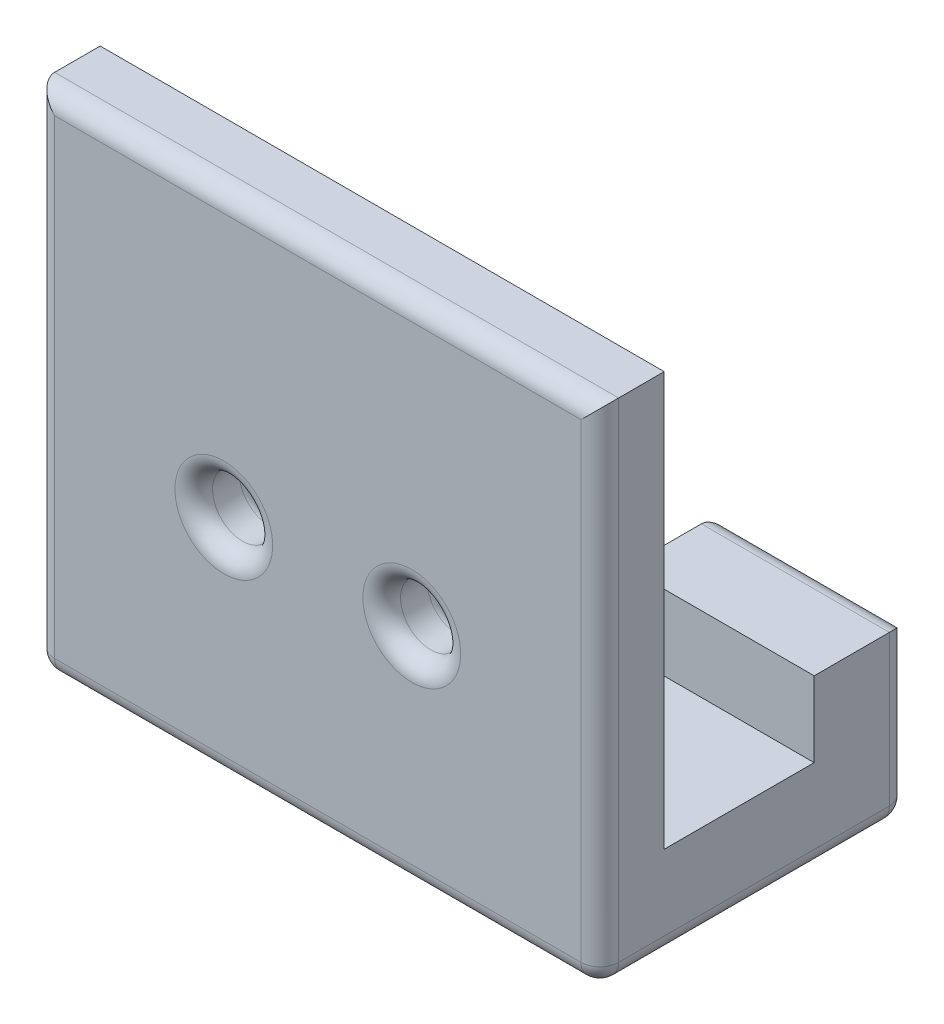
from build123d import *

# Parameters (mm, degrees)
BOSS_EXTRUDE1_DEPTH = 5
SKETCH1_3_W         = 10
SKETCH1_3_H         = 5
BOSS_EXTRUDE2_DEPTH = 9
BOSS_EXTRUDE3_DEPTH = 22
SKETCH4_R           = 1.6
CUT_EXTRUDE1_DEPTH  = 3.424711692
FILLET1_R           = 1
FILLET2_R           = 1


with BuildPart() as part:
    # Sketch1 → Boss-Extrude1 (new body)
    with BuildSketch(Plane(origin=(0, 0, 0), x_dir=(1, 0, 0), z_dir=(0, 1, 0))):
        Polygon((-44.61462686, -35.123247006), (-14.61462686, -35.123247006), (-14.61462686, -18.720861087), (-24.61462686, -18.720861087), (-24.61462686, -25.920861087), (-34.61462686, -25.920861087), (-34.61462686, -18.720861087), (-44.61462686, -18.720861087), align=None)
    extrude(amount=BOSS_EXTRUDE1_DEPTH)

    # Sketch1<3> → Boss-Extrude2 (add)
    with BuildSketch(Plane(origin=(0, 0, 0), x_dir=(1, 0, 0), z_dir=(0, 1, 0))):
        with Locations((-39.61462686, -21.220861087)):
            Rectangle(SKETCH1_3_W, SKETCH1_3_H)
        with Locations((-19.61462686, -21.220861087)):
            Rectangle(SKETCH1_3_W, SKETCH1_3_H)
    extrude(amount=BOSS_EXTRUDE2_DEPTH)

    # Sketch3 → Boss-Extrude3 (add)
    with BuildSketch(Plane(origin=(0, 5, 0), x_dir=(1, 0, 0), z_dir=(0, 1, 0))):
        Polygon((-34.61462686, -31.698535314), (-44.61462686, -31.698535314), (-44.61462686, -35.123247006), (-14.61462686, -35.123247006), (-14.61462686, -31.698535314), align=None)
    extrude(amount=BOSS_EXTRUDE3_DEPTH)

    # Sketch4 → Cut-Extrude1 (cut)
    with BuildSketch(Plane(origin=(0, 0, 31.698535314), x_dir=(-1, 0, 0), z_dir=(0, 0, -1))):
        with Locations((34.61462686, 12)):
            Circle(SKETCH4_R)
        with Locations((24.61462686, 12)):
            Circle(SKETCH4_R)
    extrude(amount=-CUT_EXTRUDE1_DEPTH, mode=Mode.SUBTRACT)

    # Fillet1
    fillet1_edges = [part.edges().sort_by_distance(p)[0] for p in [
        (-33.01462686, 12, 31.698535314),
        (-33.01462686, 12, 35.123247006),
        (-23.01462686, 12, 31.698535314),
        (-23.01462686, 12, 35.123247006),
    ]]
    fillet(fillet1_edges, radius=FILLET1_R)

    # Fillet2
    fillet2_edges = [part.edges().sort_by_distance(p)[0] for p in [
        (-39.61462686, 0, 18.720861087),
        (-34.61462686, 0, 22.320861087),
        (-29.61462686, 0, 25.920861087),
        (-24.61462686, 0, 22.320861087),
        (-19.61462686, 0, 18.720861087),
        (-14.61462686, 0, 26.922054046),
        (-14.61462686, 13.5, 35.123247006),
        (-44.61462686, 13.5, 35.123247006),
        (-44.61462686, 4.5, 18.720861087),
        (-34.61462686, 4.5, 18.720861087),
        (-24.61462686, 4.5, 18.720861087),
        (-14.61462686, 4.5, 18.720861087),
        (-39.61462686, 9, 18.720861087),
        (-19.61462686, 9, 18.720861087),
        (-29.61462686, 27, 35.123247006),
        (-29.61462686, 0, 35.123247006),
        (-44.61462686, 0, 26.922054046),
    ]]
    fillet(fillet2_edges, radius=FILLET2_R)


solid = part.part
